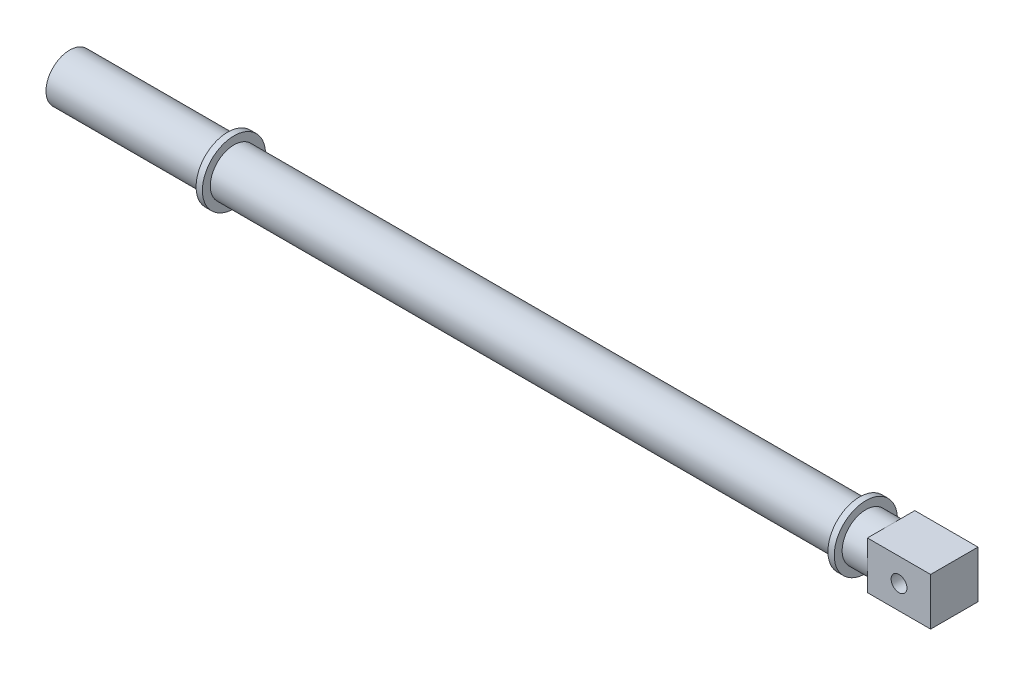
from build123d import *

# Parameters (mm, degrees)
ESBO_O1_W                     = 280
ESBO_O1_H                     = 7.5
ESBO_O3_W                     = 2
ESBO_O3_H                     = 10
RESSALTO_EXTRUS_O1_DEPTH      = 7.5
RESSALTO_EXTRUS_O1_DEPTH_BACK = 7.5
ESBO_O4_W                     = 20
ESBO_O4_H                     = 15
CORTE_EXTRUS_O1_DEPTH         = 7.5
CORTE_EXTRUS_O1_DEPTH_BACK    = 7.5
ESBO_O2_R                     = 2.5


with BuildPart() as part:
    # Esboço1 → Revolução1 (revolve)
    with BuildSketch(Plane.XY):
        with Locations((140, -3.75)):
            Rectangle(ESBO_O1_W, ESBO_O1_H)
    revolve(axis=Axis((0, 0, 0), (1, 0, 0)))

    # Esboço3 → Revolução2 (revolve)
    with BuildSketch(Plane.XY):
        with Locations((251, -5)):
            Rectangle(ESBO_O3_W, ESBO_O3_H)
        with Locations((51, -5)):
            Rectangle(ESBO_O3_W, ESBO_O3_H)
    revolve(axis=Axis((50, 0, 0), (1, 0, 0)))

    # Esboço4 → Ressalto-extrusão1 (add, two sides: drawn at the far end of the back side and taken through both)
    with BuildSketch(Plane.XY.offset(-RESSALTO_EXTRUS_O1_DEPTH_BACK)):
        with Locations((270, 0)):
            Rectangle(ESBO_O4_W, ESBO_O4_H)
    extrude(amount=RESSALTO_EXTRUS_O1_DEPTH + RESSALTO_EXTRUS_O1_DEPTH_BACK)

    # Esboço2 → Corte-extrusão1 (cut, two sides: drawn at the far end of the back side and taken through both)
    with BuildSketch(Plane.XY.offset(-CORTE_EXTRUS_O1_DEPTH_BACK)):
        with Locations((270, 0)):
            Circle(ESBO_O2_R)
    extrude(amount=CORTE_EXTRUS_O1_DEPTH + CORTE_EXTRUS_O1_DEPTH_BACK, mode=Mode.SUBTRACT)


solid = part.part
